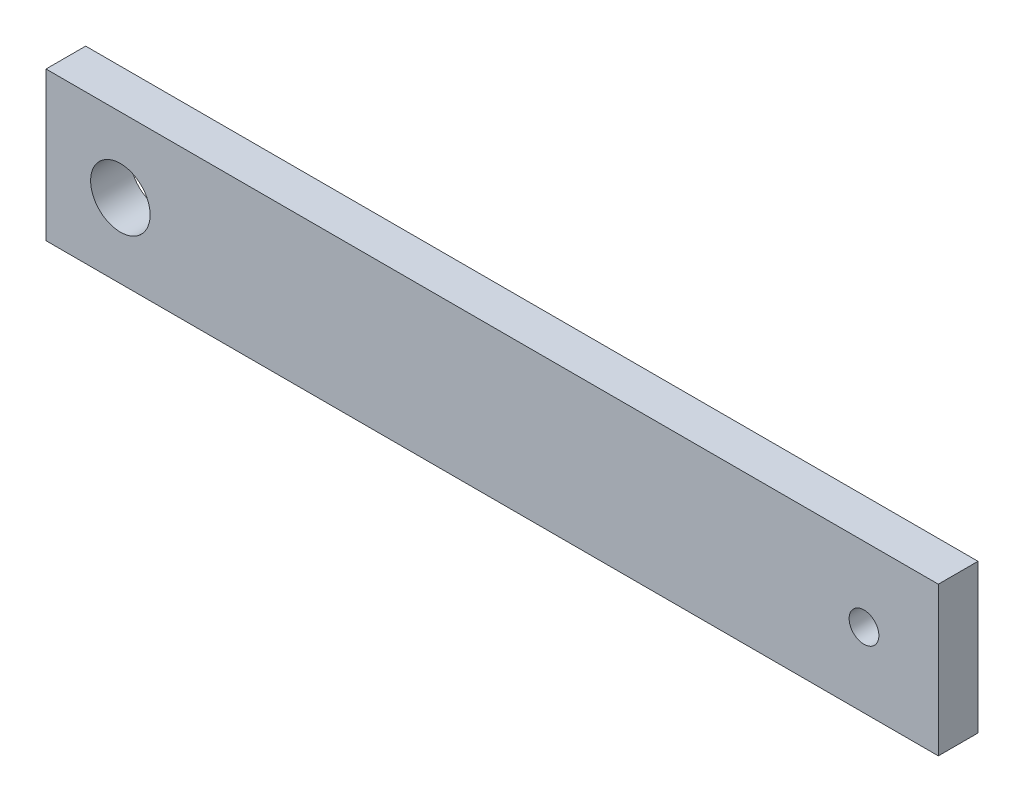
from build123d import *

# Parameters (mm, degrees)
SKETCH_1_W      = 180
SKETCH_1_H      = 30
SKETCH_1_R      = 6
SKETCH_1_R_2    = 3
EXTRUDE_1_DEPTH = 8


with BuildPart() as part:
    # 草图1 → 凸台-拉伸1 (new body)
    with BuildSketch(Plane.XY):
        Rectangle(SKETCH_1_W, SKETCH_1_H)
        with Locations((-75, 0)):
            Circle(SKETCH_1_R, mode=Mode.SUBTRACT)
        with Locations((75, 0)):
            Circle(SKETCH_1_R_2, mode=Mode.SUBTRACT)
    extrude(amount=EXTRUDE_1_DEPTH)


solid = part.part
